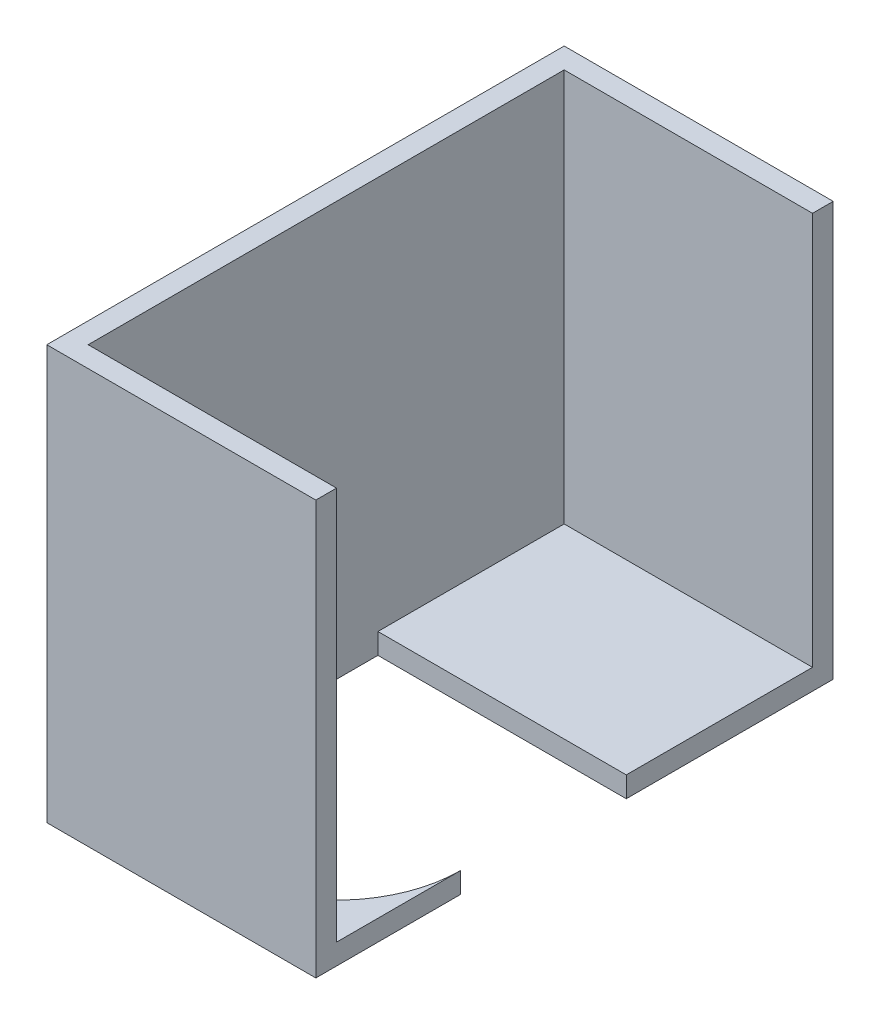
from build123d import *

# Parameters (mm, degrees)
SKETCH_15_W          = 13
SKETCH_15_H          = 25
EXTRUDE_4_DEPTH      = 20
CUT_EXTRUDE_START    = 1
SKETCH_16_W          = 12
SKETCH_16_H          = 23
CUT_EXTRUDE_47_DEPTH = 24.6018292
CUT_EXTRUDE_48_DEPTH = 25.6018292


with BuildPart() as part:
    # 스케치15 → 보스-돌출4 (new body)
    with BuildSketch(Plane(origin=(0, 0, 0), x_dir=(1, 0, 0), z_dir=(0, 1, 0))):
        with Locations((0.5, 0)):
            Rectangle(SKETCH_15_W, SKETCH_15_H)
    extrude(amount=EXTRUDE_4_DEPTH)

    # 스케치16 → 컷-돌출47 (cut, through all)
    with BuildSketch(Plane(origin=(0, 0, 0), x_dir=(1, 0, 0), z_dir=(0, 1, 0)).offset(CUT_EXTRUDE_START)):
        with Locations((1, 0)):
            Rectangle(SKETCH_16_W, SKETCH_16_H)
    extrude(amount=CUT_EXTRUDE_47_DEPTH, mode=Mode.SUBTRACT)

    # 스케치17 → 컷-돌출48 (cut, through all)
    with BuildSketch(Plane(origin=(0, 0, 0), x_dir=(1, 0, 0), z_dir=(0, 1, 0))):
        with BuildLine():
            Line((-5, 2.5), (7, 2.5))
            Line((7, 2.5), (7, -5.5))
            ThreePointArc((7, -5.5), (1, -11.5), (-5, -5.5))
            Line((-5, -5.5), (-5, 2.5))
        make_face()
    extrude(amount=CUT_EXTRUDE_48_DEPTH, mode=Mode.SUBTRACT)


solid = part.part
